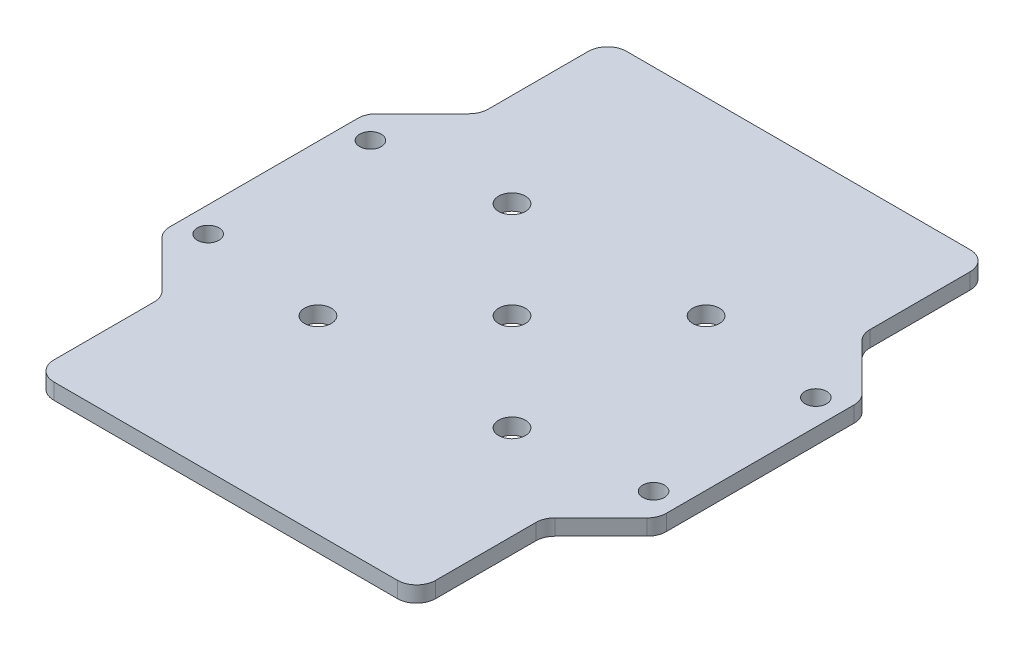
from build123d import *

# Parameters (mm, degrees)
SKETCH1_W                  = 60
SKETCH1_H                  = 90
BOSS_EXTRUDE1_DEPTH        = 1.25
FILLET1_R                  = 3
F_4_2_4_2_DIAMETER_HOLE1_D = 4.2
M3_CLEARANCE_HOLE1_D       = 3.4


with BuildPart() as part:
    # Sketch1 → Boss-Extrude1 (new, symmetric)
    with BuildSketch(Plane(origin=(0, 0, 0), x_dir=(1, 0, 0), z_dir=(0, 1, 0))):
        Polygon((30, 45), (-30, 45), (-30, 25), (-30, -25), (-30, -45), (30, -45), (30, -25), (30, 25), align=None)
        Rectangle(SKETCH1_W, SKETCH1_H)
        Polygon((-30, -25), (-30, 25), (-39, 16), (-39, -16), align=None)
        Polygon((39, 16), (30, 25), (30, -25), (39, -16), align=None)
    extrude(amount=BOSS_EXTRUDE1_DEPTH, both=True)

    # Fillet1
    fillet1_edges = [part.edges().sort_by_distance(p)[0] for p in [
        (30, 0, -25),
        (39, 0, -16),
        (39, 0, 16),
        (30, 0, 25),
        (30, 0, 45),
        (-30, 0, 45),
        (-30, 0, 25),
        (-39, 0, 16),
        (-39, 0, -16),
        (-30, 0, -25),
        (-30, 0, -45),
        (30, 0, -45),
    ]]
    fillet(fillet1_edges, radius=FILLET1_R)

    # Ø4.2 (4.2) Diameter Hole1 (through all)
    with Locations(Plane(origin=(0, 1.25, 0), x_dir=(1, 0, 0), z_dir=(0, 1, 0))):
        with Locations((0, 0), (15.25, -15.25), (-15.25, 15.25), (-15.25, -15.25), (15.25, 15.25)):
            Hole(F_4_2_4_2_DIAMETER_HOLE1_D / 2)

    # M3 Clearance Hole1 (through all)
    with Locations(Plane(origin=(0, 1.25, 0), x_dir=(1, 0, 0), z_dir=(0, 1, 0))):
        with Locations((35, 12.75), (35, -12.75), (-35, -12.75), (-35, 12.75)):
            Hole(M3_CLEARANCE_HOLE1_D / 2)


solid = part.part
